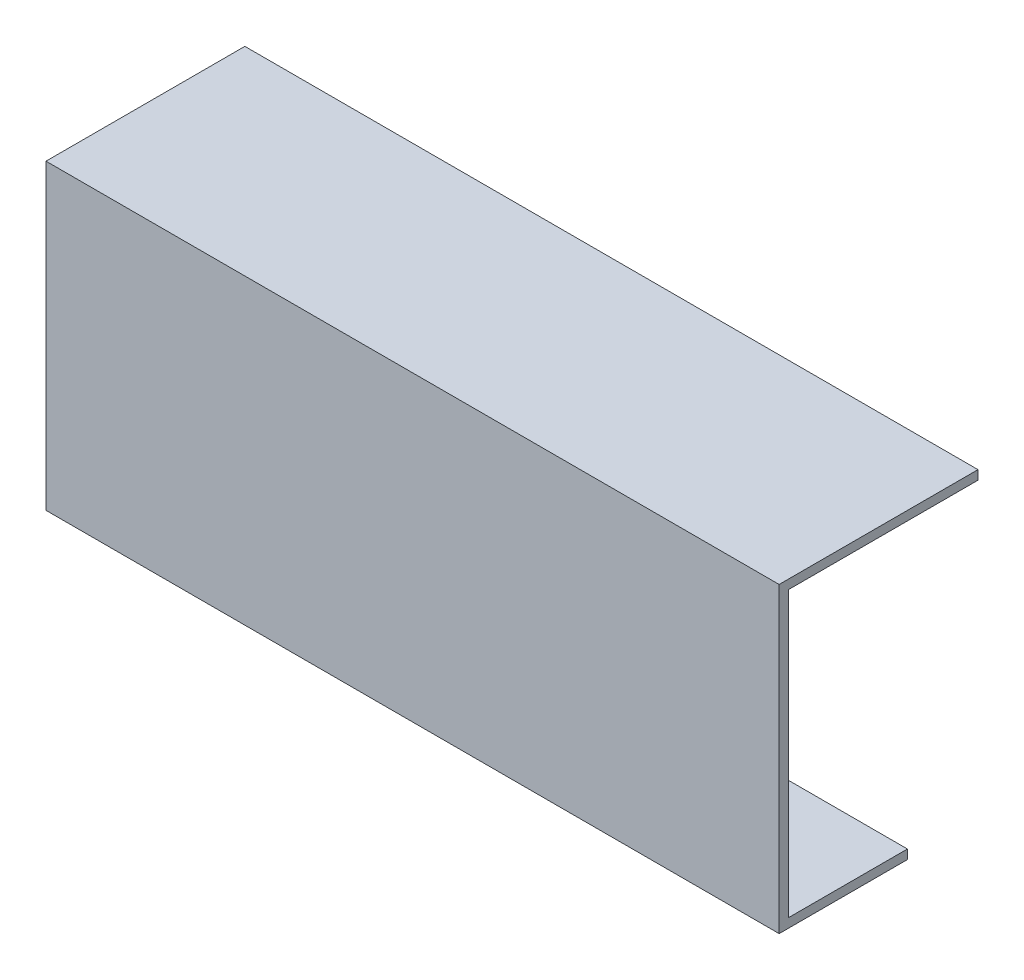
from build123d import *

# Parameters (mm, degrees)
SKETCH1_W           = 203.2
SKETCH1_H           = 83.82
BOSS_EXTRUDE1_DEPTH = 55.118
CUT_EXTRUDE1_DEPTH  = 227.614267697


with BuildPart() as part:
    # Sketch1 → Boss-Extrude1 (new body)
    with BuildSketch(Plane.XY):
        with Locations((101.6, -41.91)):
            Rectangle(SKETCH1_W, SKETCH1_H)
    extrude(amount=BOSS_EXTRUDE1_DEPTH)

    # Sketch2 → Cut-Extrude1 (cut, through all)
    with BuildSketch(Plane(origin=(203.2, 0, 0), x_dir=(0, 0, -1), z_dir=(1, 0, 0))):
        Polygon((-19.558, -83.82), (-19.558, -81.28), (-52.578, -81.28), (-52.578, -2.54), (0, -2.54), (0, -83.82), align=None)
    extrude(amount=-CUT_EXTRUDE1_DEPTH, mode=Mode.SUBTRACT)


solid = part.part
